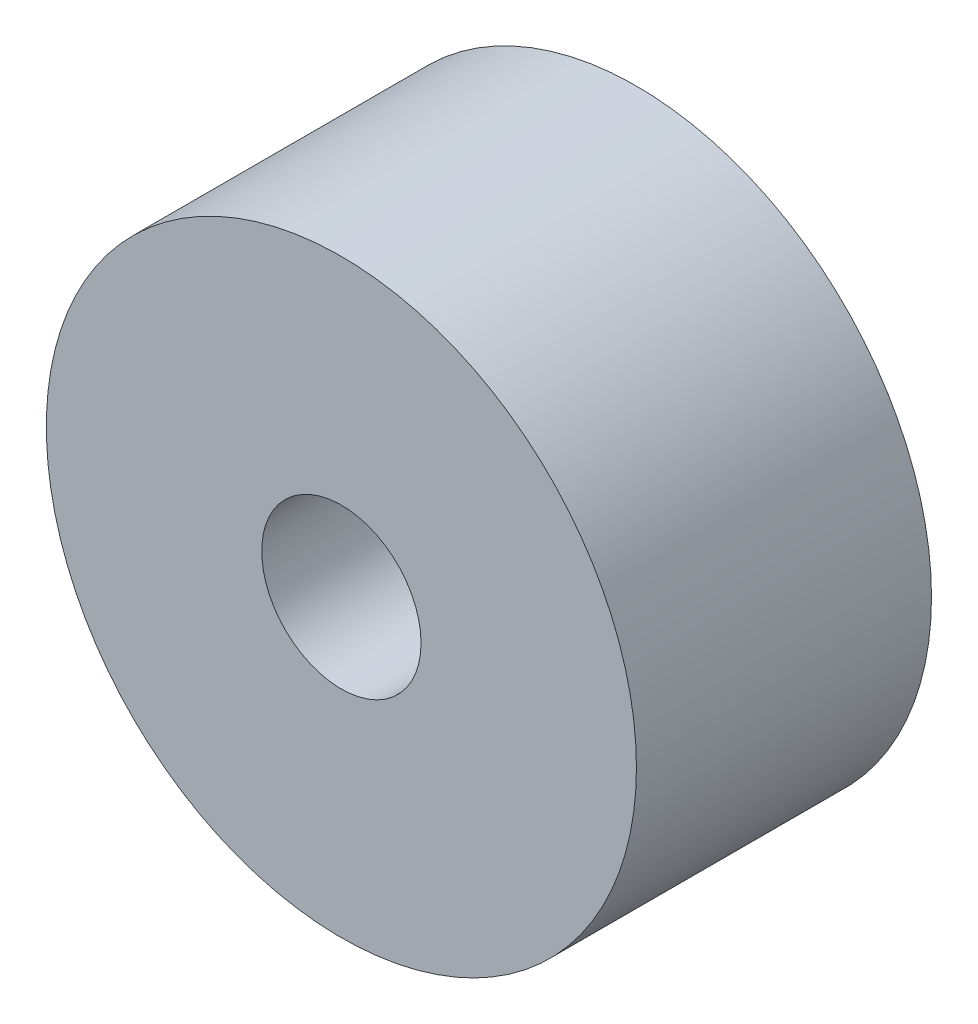
from build123d import *

# Parameters (mm, degrees)
SKETCH_1_R      = 10
SKETCH_1_R_2    = 2.7
EXTRUDE_1_DEPTH = 10


with BuildPart() as part:
    # 草图1 → 凸台-拉伸1 (new body)
    with BuildSketch(Plane.XY):
        Circle(SKETCH_1_R)
        Circle(SKETCH_1_R_2, mode=Mode.SUBTRACT)
    extrude(amount=EXTRUDE_1_DEPTH)


solid = part.part
